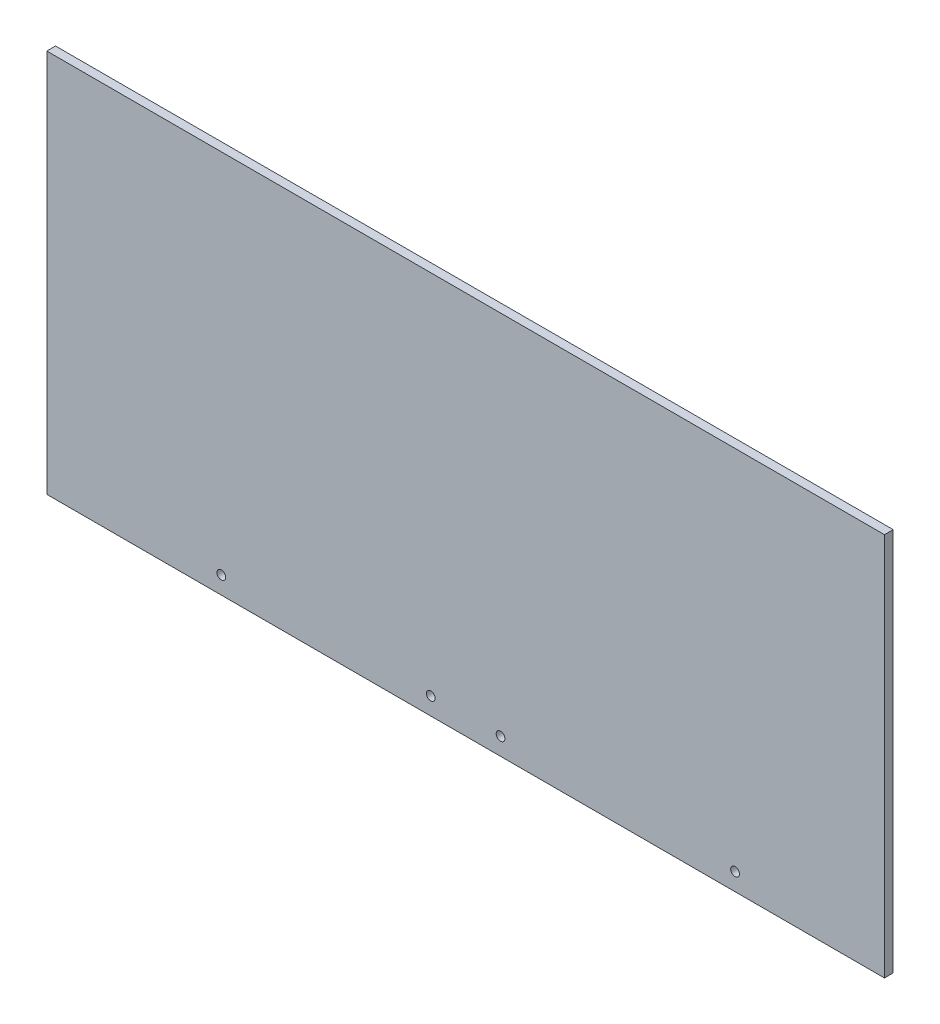
from build123d import *

# Parameters (mm, degrees)
SKETCH1_W           = 152.4
SKETCH1_H           = 279.4
SKETCH1_R           = 3.175
BOSS_EXTRUDE1_DEPTH = 6.35


with BuildPart() as part:
    # Sketch1 → Boss-Extrude1 (new body)
    # profile 1 of 4: a face of its own
    with BuildSketch(Plane.XY):
        with Locations((-248.612121212, -61.832323232)):
            Rectangle(SKETCH1_W, SKETCH1_H)
        with Locations((-197.812121212, -188.832323232)):
            Circle(SKETCH1_R, mode=Mode.SUBTRACT)
    # profile 2 of 4: a face of its own
    with BuildSketch(Plane.XY):
        with Locations((-96.212121212, -61.832323232)):
            Rectangle(SKETCH1_W, SKETCH1_H)
        with Locations((-45.412121212, -188.832323232)):
            Circle(SKETCH1_R, mode=Mode.SUBTRACT)
    # profile 3 of 4: a face of its own
    with BuildSketch(Plane.XY):
        with Locations((56.187878788, -61.832323232)):
            Rectangle(SKETCH1_W, SKETCH1_H)
        with Locations((5.387878788, -188.832323232)):
            Circle(SKETCH1_R, mode=Mode.SUBTRACT)
    # profile 4 of 4: a face of its own
    with BuildSketch(Plane.XY):
        with Locations((208.587878788, -61.832323232)):
            Rectangle(SKETCH1_W, SKETCH1_H)
        with Locations((176.050478788, -188.832323232)):
            Circle(SKETCH1_R, mode=Mode.SUBTRACT)
    extrude(amount=BOSS_EXTRUDE1_DEPTH)


solid = part.part
